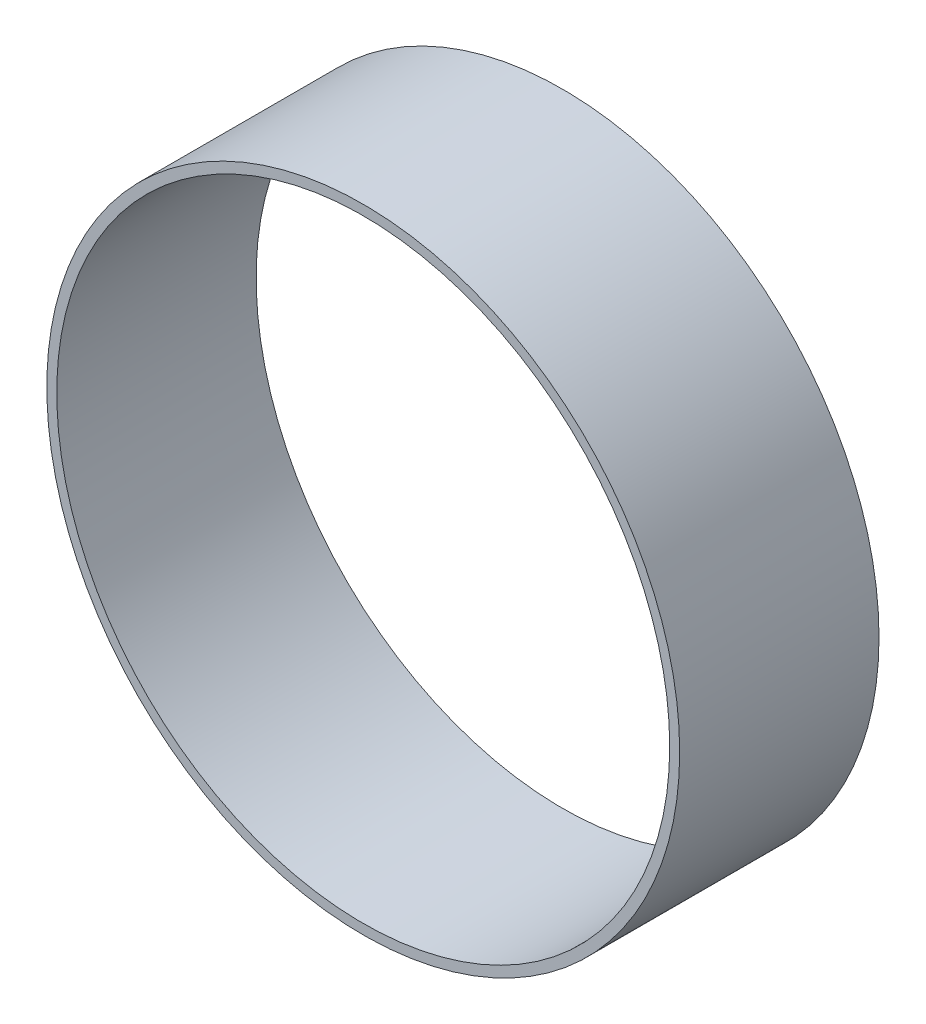
from build123d import *

# Parameters (mm, degrees)
SKETCH1_R           = 63.5
SKETCH1_R_2         = 61.5
BOSS_EXTRUDE1_DEPTH = 40


with BuildPart() as part:
    # Sketch1 → Boss-Extrude1 (new body)
    with BuildSketch(Plane.XY):
        Circle(SKETCH1_R)
        Circle(SKETCH1_R_2, mode=Mode.SUBTRACT)
    extrude(amount=BOSS_EXTRUDE1_DEPTH)


solid = part.part
